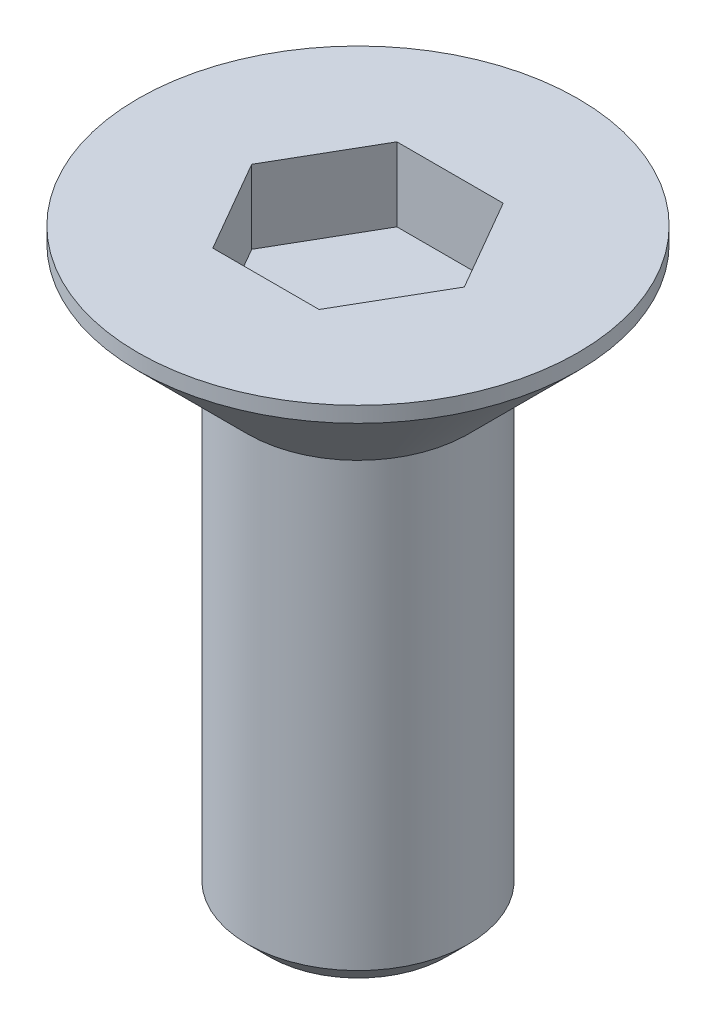
from build123d import *

# Parameters (mm, degrees)
CHAFL_N2_SIZE         = 0.3
CHAFL_N2_SIZE2        = 0.212132034
CHAFL_N3_SIZE         = 0.3
CORTAR_EXTRUIR2_DEPTH = 1


with BuildPart() as part:
    # Croquis1 → Revolución1 (revolve)
    with BuildSketch(Plane.XY, mode=Mode.PRIVATE) as revoluci_n1_sk:
        Polygon((0, 0), (3.2, 0), (1.5, -1.7), (1.5, -8), (0, -8), align=None)
    revolve(revoluci_n1_sk.sketch.rotate(Axis((0, 0, 0), (0, -1, 0)), 90), axis=Axis((0, 0, 0), (0, -1, 0)))

    # Chaflán2
    chafl_n2_edges = [part.edges().sort_by_distance(p)[0] for p in [
        (0, 0, -3.2),
    ]]
    chafl_n2_side = [part.faces().sort_by_distance(p)[0] for p in [
        (0, -0.85, -2.35),
    ]]
    chamfer(chafl_n2_edges, length=CHAFL_N2_SIZE, length2=CHAFL_N2_SIZE2, reference=chafl_n2_side[0])

    # Chaflán3
    chafl_n3_edges = [part.edges().sort_by_distance(p)[0] for p in [
        (0, -8, -1.5),
    ]]
    chamfer(chafl_n3_edges, length=CHAFL_N3_SIZE)

    # Croquis3 → Cortar-Extruir2 (cut)
    with BuildSketch(Plane(origin=(0, 0, 0), x_dir=(1, 0, 0), z_dir=(0, 1, 0))):
        Polygon((-0.721687836, 1.25), (-1.443375673, 0), (-0.721687836, -1.25), (0.721687836, -1.25), (1.443375673, 0), (0.721687836, 1.25), align=None)
    extrude(amount=-CORTAR_EXTRUIR2_DEPTH, mode=Mode.SUBTRACT)


solid = part.part
